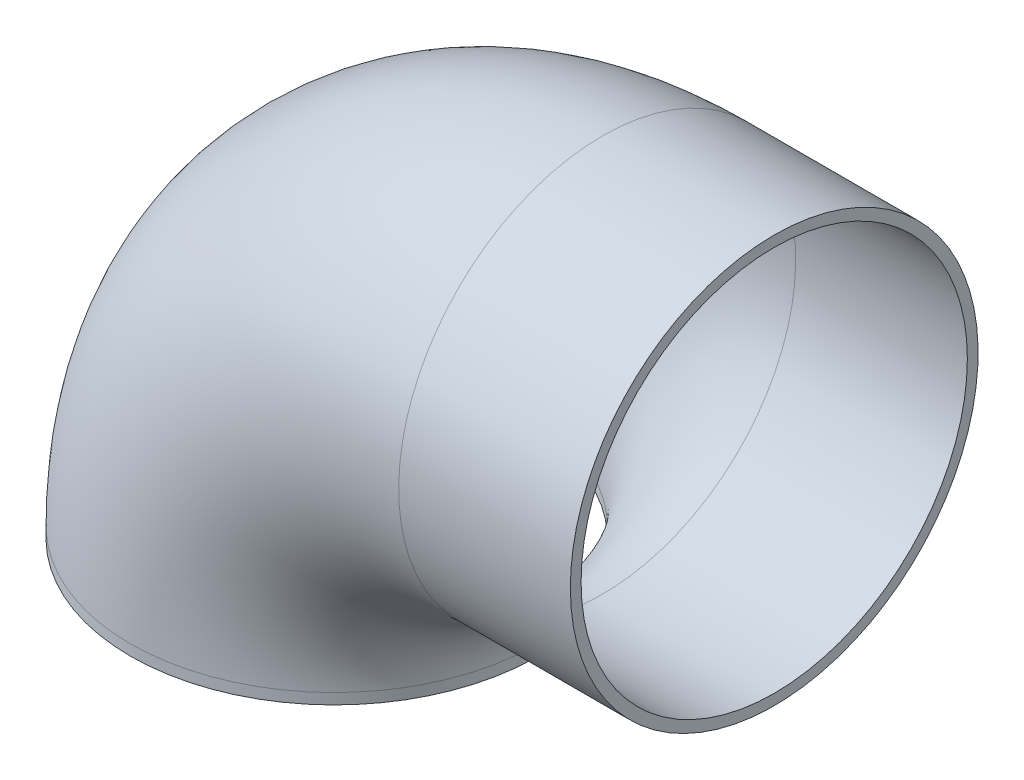
from build123d import *

# Parameters (mm, degrees)
SKETCH2_R   = 38
SKETCH2_R_2 = 36


with BuildPart() as part:
    # Sweep1: sweep along a path in Sketch1
    with BuildLine(Plane.XY) as sweep1_path:
        Line((0, 0), (0, 2))
        ThreePointArc((0, 2), (14.644660941, 37.355339059), (50, 52))
        Line((50, 52), (82, 52))
    # Sketch2 → Sweep1 (sweep)
    with BuildSketch(Plane(origin=(0, 0, 0), x_dir=(1, 0, 0), z_dir=(0, 1, 0))):
        Circle(SKETCH2_R)
        Circle(SKETCH2_R_2, mode=Mode.SUBTRACT)
    sweep(path=sweep1_path.line)


solid = part.part
